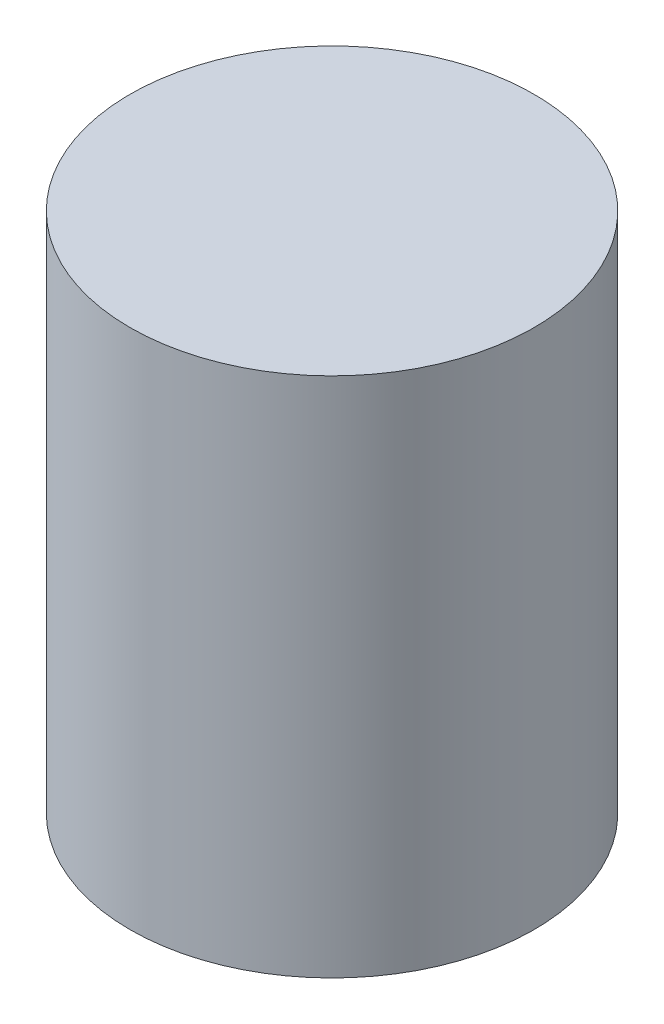
from build123d import *

# Parameters (mm, degrees)
SKETCH1_R           = 3.1
SKETCH1_R_2         = 1.975
BOSS_EXTRUDE1_DEPTH = 8
SKETCH1_4_R         = 1.975
CUT_EXTRUDE1_DEPTH  = 6


with BuildPart() as part:
    # Sketch1 → Boss-Extrude1 (new body)
    # profile 1 of 2: a face of its own
    with BuildSketch(Plane(origin=(0, 0, 0), x_dir=(1, 0, 0), z_dir=(0, 1, 0))):
        with Locations(Location((0, 0, 0), (0, 0, 270))):
            Circle(SKETCH1_R)
        Circle(SKETCH1_R_2, mode=Mode.SUBTRACT)
    # profile 2 of 2: a face of its own
    with BuildSketch(Plane(origin=(0, 0, 0), x_dir=(1, 0, 0), z_dir=(0, 1, 0))):
        Circle(SKETCH1_R_2)
    extrude(amount=BOSS_EXTRUDE1_DEPTH)

    # Sketch1<4> → Cut-Extrude1 (cut)
    with BuildSketch(Plane(origin=(0, 0, 0), x_dir=(1, 0, 0), z_dir=(0, 1, 0))):
        with Locations(Location((0, 0, 0), (0, 0, 270))):
            Circle(SKETCH1_4_R)
    extrude(amount=CUT_EXTRUDE1_DEPTH, mode=Mode.SUBTRACT)


solid = part.part
